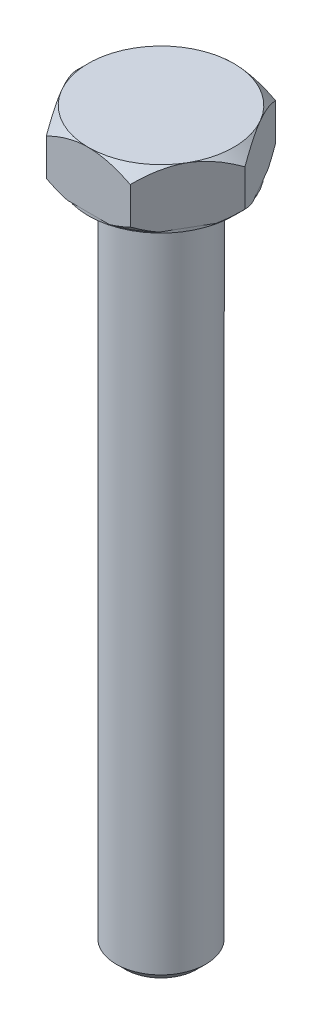
from build123d import *

# Parameters (mm, degrees)
BOSS_EXTRUDE1_DEPTH = 5.3
SKETCH2_OUTSIDE_W   = 21.122
SKETCH2_OUTSIDE_H   = 19.11
SKETCH2_OUTSIDE_R   = 6.5
CUT_EXTRUDE1_DEPTH  = 0.265
SKETCH3_R           = 4
BOSS_EXTRUDE2_DEPTH = 60
CHAMFER1_SIZE       = 0.8


with BuildPart() as part:
    # Sketch1 → Boss-Extrude1 (new body)
    with BuildSketch(Plane(origin=(0, 0, 0), x_dir=(1, 0, 0), z_dir=(0, 1, 0))):
        Polygon((7.505553499, 0), (3.75277675, 6.5), (-3.75277675, 6.5), (-7.505553499, 0), (-3.75277675, -6.5), (3.75277675, -6.5), align=None)
    extrude(amount=-BOSS_EXTRUDE1_DEPTH)

    # Sketch4 → Cut-Revolve1 (revolve, cut)
    with BuildSketch(Plane(origin=(0, 0, 0), x_dir=(0, 0, -1), z_dir=(1, 0, 0))):
        Polygon((-6.5, 0), (-8.15, 0), (-8.15, -1.65), align=None)
        Polygon((-8.15, -3.65), (-6.5, -5.3), (-8.15, -5.3), align=None)
    revolve(axis=Axis((0, 0, 0), (0, -1, 0)), mode=Mode.SUBTRACT)

    # Sketch2 outside → Cut-Extrude1 (cut)
    with BuildSketch(Plane.XZ.offset(5.3)):
        Rectangle(SKETCH2_OUTSIDE_W, SKETCH2_OUTSIDE_H)
        with Locations(Location((0, 0, 0), (0, 0, 90))):
            Circle(SKETCH2_OUTSIDE_R, mode=Mode.SUBTRACT)
    extrude(amount=-CUT_EXTRUDE1_DEPTH, mode=Mode.SUBTRACT)

    # Sketch3 → Boss-Extrude2 (add)
    with BuildSketch(Plane.XZ.offset(5.3)):
        with Locations(Location((0, 0, 0), (0, 0, 90))):
            Circle(SKETCH3_R)
    extrude(amount=BOSS_EXTRUDE2_DEPTH)

    # Chamfer1
    chamfer1_edges = [part.edges().sort_by_distance(p)[0] for p in [
        (0, -65.3, -4),
    ]]
    chamfer(chamfer1_edges, length=CHAMFER1_SIZE)


solid = part.part
